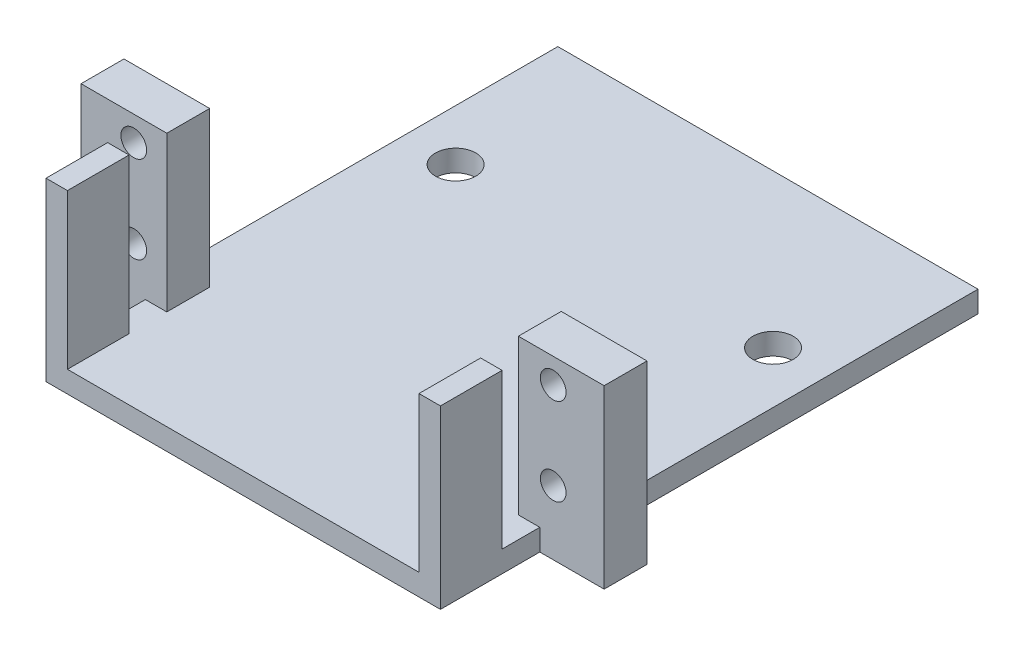
from build123d import *

# Parameters (mm, degrees)
SKETCH1_W           = 46
SKETCH1_H           = 36.614031046
BOSS_EXTRUDE1_DEPTH = 2.5
SKETCH2_W           = 2.5
SKETCH2_H           = 25.026075356
SKETCH2_H_2         = 7.18795569
BOSS_EXTRUDE2_DEPTH = 20.83511976
SKETCH4_W           = 10
SKETCH4_H           = 20.552854399
BOSS_EXTRUDE8_DEPTH = 5
SKETCH5_W           = 20.026075356
SKETCH5_H           = 23.33511976
CUT_EXTRUDE1_DEPTH  = 100
SKETCH6_W           = 49
SKETCH6_H           = 2.5
BOSS_EXTRUDE9_DEPTH = 44.601756686
SKETCH7_R           = 2.35
CUT_EXTRUDE2_DEPTH  = 57
SKETCH9_W           = 16.58795569
SKETCH9_H           = 2.782265361
CUT_EXTRUDE3_DEPTH  = 47
SKETCH10_R          = 1.5
CUT_EXTRUDE4_DEPTH  = 10


with BuildPart() as part:
    # Sketch1 → Boss-Extrude1 (new body)
    with BuildSketch(Plane(origin=(0, 0, 0), x_dir=(1, 0, 0), z_dir=(0, 1, 0))):
        with Locations((23, 18.307015523)):
            Rectangle(SKETCH1_W, SKETCH1_H)
    extrude(amount=BOSS_EXTRUDE1_DEPTH)

    # Sketch2 → Boss-Extrude2 (add)
    with BuildSketch(Plane(origin=(0, 2.5, 0), x_dir=(1, 0, 0), z_dir=(0, 1, 0))):
        with Locations((1.25, 24.100993368)):
            Rectangle(SKETCH2_W, SKETCH2_H)
        with Locations((1.25, 3.593977845)):
            Rectangle(SKETCH2_W, SKETCH2_H_2)
        with Locations((44.75, 3.593977845)):
            Rectangle(SKETCH2_W, SKETCH2_H_2)
        with Locations((44.75, 24.100993368)):
            Rectangle(SKETCH2_W, SKETCH2_H)
    extrude(amount=BOSS_EXTRUDE2_DEPTH)

    # Sketch4 → Boss-Extrude8 (add)
    with BuildSketch(Plane.XY.offset(-11.58795569)):
        with Locations((-2.5, 10.2764272)):
            Rectangle(SKETCH4_W, SKETCH4_H)
        with Locations((48.5, 10.2764272)):
            Rectangle(SKETCH4_W, SKETCH4_H)
    extrude(amount=-BOSS_EXTRUDE8_DEPTH)

    # Sketch5 → Cut-Extrude1 (cut)
    with BuildSketch(Plane.ZY):
        with Locations((-26.600993368, 11.66755988)):
            Rectangle(SKETCH5_W, SKETCH5_H)
    extrude(amount=-CUT_EXTRUDE1_DEPTH, mode=Mode.SUBTRACT)

    # Sketch6 → Boss-Extrude9 (add)
    with BuildSketch(Plane(origin=(0, 0, -16.58795569), x_dir=(-1, 0, 0), z_dir=(0, 0, -1))):
        with Locations((-23, 1.25)):
            Rectangle(SKETCH6_W, SKETCH6_H)
    extrude(amount=BOSS_EXTRUDE9_DEPTH)

    # Sketch7 → Cut-Extrude2 (cut)
    with BuildSketch(Plane(origin=(0, 2.5, 0), x_dir=(1, 0, 0), z_dir=(0, 1, 0))):
        with Locations(Location((4.458214718, 43.313777074, 0), (0, 0, 270))):
            Circle(SKETCH7_R)
        with Locations(Location((41.472783072, 43.313777074, 0), (0, 0, 270))):
            Circle(SKETCH7_R)
    extrude(amount=-CUT_EXTRUDE2_DEPTH, mode=Mode.SUBTRACT)

    # Sketch9 → Cut-Extrude3 (cut)
    with BuildSketch(Plane.ZY):
        with Locations((-8.293977845, 21.94398708)):
            Rectangle(SKETCH9_W, SKETCH9_H)
    extrude(amount=-CUT_EXTRUDE3_DEPTH, mode=Mode.SUBTRACT)

    # Sketch10 → Cut-Extrude4 (cut)
    with BuildSketch(Plane.XY.offset(-11.58795569)):
        with Locations((-1.353500868, 17.657737488)):
            Circle(SKETCH10_R)
        with Locations((-1.353500868, 7.492318257)):
            Circle(SKETCH10_R)
        with Locations((47.56068481, 17.657737488)):
            Circle(SKETCH10_R)
        with Locations((47.56068481, 7.492318257)):
            Circle(SKETCH10_R)
    extrude(amount=-CUT_EXTRUDE4_DEPTH, mode=Mode.SUBTRACT)


solid = part.part
